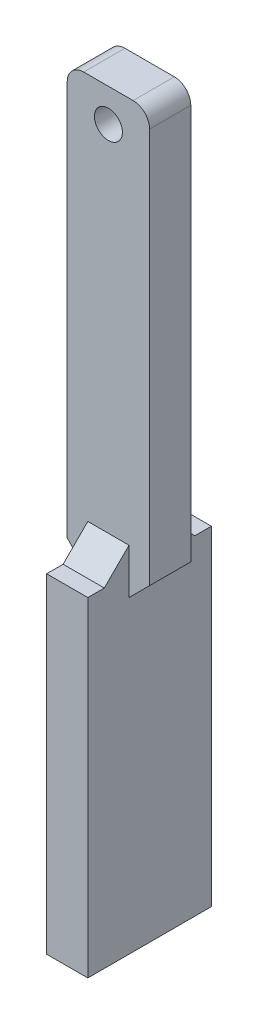
from build123d import *

# Parameters (mm, degrees)
Y_KSEKLIK_EKSTR_ZYON1_DEPTH = 5
RADYUS1_R                   = 2
IZIM2_R                     = 1.7
KES_EKSTR_ZYON1_DEPTH       = 12
Y_KSEKLIK_EKSTR_ZYON2_DEPTH = 40
PAH1_SIZE                   = 3


with BuildPart() as part:
    # Çizim1 → Yükseklik-Ekstrüzyon1 (new body)
    with BuildSketch(Plane.XY):
        Polygon((0, 0), (10, 0), (10, -50), (5.050252532, -54.949747468), (0, -50), align=None)
    extrude(amount=Y_KSEKLIK_EKSTR_ZYON1_DEPTH)

    # Radyus1
    radyus1_edges = [part.edges().sort_by_distance(p)[0] for p in [
        (0, 0, 2.5),
        (10, 0, 2.5),
    ]]
    fillet(radyus1_edges, radius=RADYUS1_R)

    # Çizim2 → Kes-Ekstrüzyon1 (cut)
    with BuildSketch(Plane.XY.offset(5)):
        with Locations((5, -4)):
            Circle(IZIM2_R)
    extrude(amount=-KES_EKSTR_ZYON1_DEPTH, mode=Mode.SUBTRACT)

    # Çizim3 → Yükseklik-Ekstrüzyon2 (add)
    with BuildSketch(Plane.XZ.offset(50)):
        Polygon((7.5, 10), (2.5, 10), (2.5, -5), (3.3, -5), (7.5, -5), align=None)
    extrude(amount=Y_KSEKLIK_EKSTR_ZYON2_DEPTH)

    # Pah1
    pah1_edges = [part.edges().sort_by_distance(p)[0] for p in [
        (5, -50, 0),
        (5, -50, 5),
    ]]
    chamfer(pah1_edges, length=PAH1_SIZE)


solid = part.part
